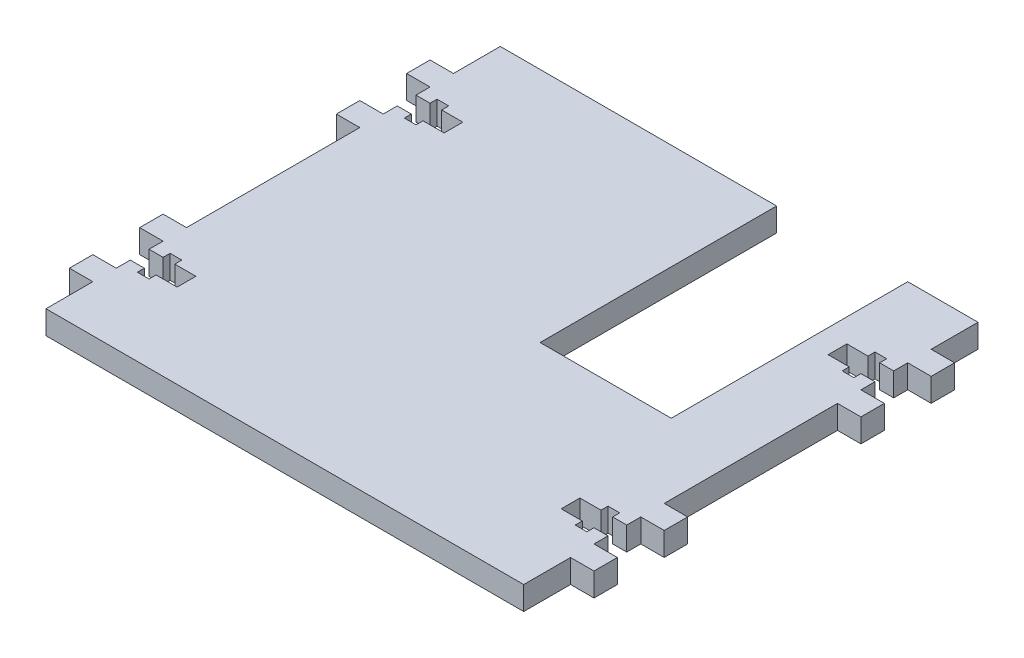
from build123d import *

# Parameters (mm, degrees)
BOSS_EXTRUDE2_DEPTH = 5


with BuildPart() as part:
    # Sketch2 → Boss-Extrude2 (new body)
    with BuildSketch(Plane(origin=(0, 0, 0), x_dir=(1, 0, 0), z_dir=(0, 1, 0))):
        Polygon((143.481880544, 36.328109734), (143.481880544, 33.328109734), (140.481880544, 33.328109734), (140.481880544, 34.828109734), (137.981880544, 34.828109734), (137.981880544, 33.328109734), (133.481880544, 33.328109734), (133.481880544, 29.328109734), (137.981880544, 29.328109734), (137.981880544, 27.828109734), (140.481880544, 27.828109734), (140.481880544, 29.328109734), (143.481880544, 29.328109734), (143.481880544, 26.328109734), (148.481880544, 26.328109734), (148.481880544, 21.328109734), (143.481880544, 21.328109734), (143.481880544, -15.671890266), (148.481880544, -15.671890266), (148.481880544, -20.671890266), (143.481880544, -20.671890266), (143.481880544, -23.671890266), (140.481880544, -23.671890266), (140.481880544, -22.171890266), (137.981880544, -22.171890266), (137.981880544, -23.671890266), (133.481880544, -23.671890266), (133.481880544, -27.671890266), (137.981880544, -27.671890266), (137.981880544, -29.171890266), (140.481880544, -29.171890266), (140.481880544, -27.671890266), (143.481880544, -27.671890266), (143.481880544, -30.671890266), (148.481880544, -30.671890266), (148.481880544, -35.671890266), (143.481880544, -35.671890266), (143.481880544, -45.671890266), (41.481880544, -45.671890266), (41.481880544, -35.671890266), (36.481880544, -35.671890266), (36.481880544, -30.671890266), (41.481880544, -30.671890266), (41.481880544, -27.671890266), (44.481880544, -27.671890266), (44.481880544, -29.171890266), (46.981880544, -29.171890266), (46.981880544, -27.671890266), (51.481880544, -27.671890266), (51.481880544, -23.671890266), (46.981880544, -23.671890266), (46.981880544, -22.171890266), (44.481880544, -22.171890266), (44.481880544, -23.671890266), (41.481880544, -23.671890266), (41.481880544, -20.671890266), (36.481880544, -20.671890266), (36.481880544, -15.671890266), (41.481880544, -15.671890266), (41.481880544, 21.328109734), (36.481880544, 21.328109734), (36.481880544, 26.328109734), (41.481880544, 26.328109734), (41.481880544, 29.328109734), (44.481880544, 29.328109734), (44.481880544, 27.828109734), (46.981880544, 27.828109734), (46.981880544, 29.328109734), (51.481880544, 29.328109734), (51.481880544, 33.328109734), (46.981880544, 33.328109734), (46.981880544, 34.828109734), (44.481880544, 34.828109734), (44.481880544, 33.328109734), (41.481880544, 33.328109734), (41.481880544, 36.328109734), (36.481880544, 36.328109734), (36.481880544, 41.328109734), (41.481880544, 41.328109734), (41.481880544, 51.328109734), (100.481880544, 51.328109734), (100.481880544, 0.828109734), (128.481880544, 0.828109734), (128.481880544, 51.328109734), (143.481880544, 51.328109734), (143.481880544, 41.328109734), (148.481880544, 41.328109734), (148.481880544, 36.328109734), align=None)
    extrude(amount=BOSS_EXTRUDE2_DEPTH)


solid = part.part
